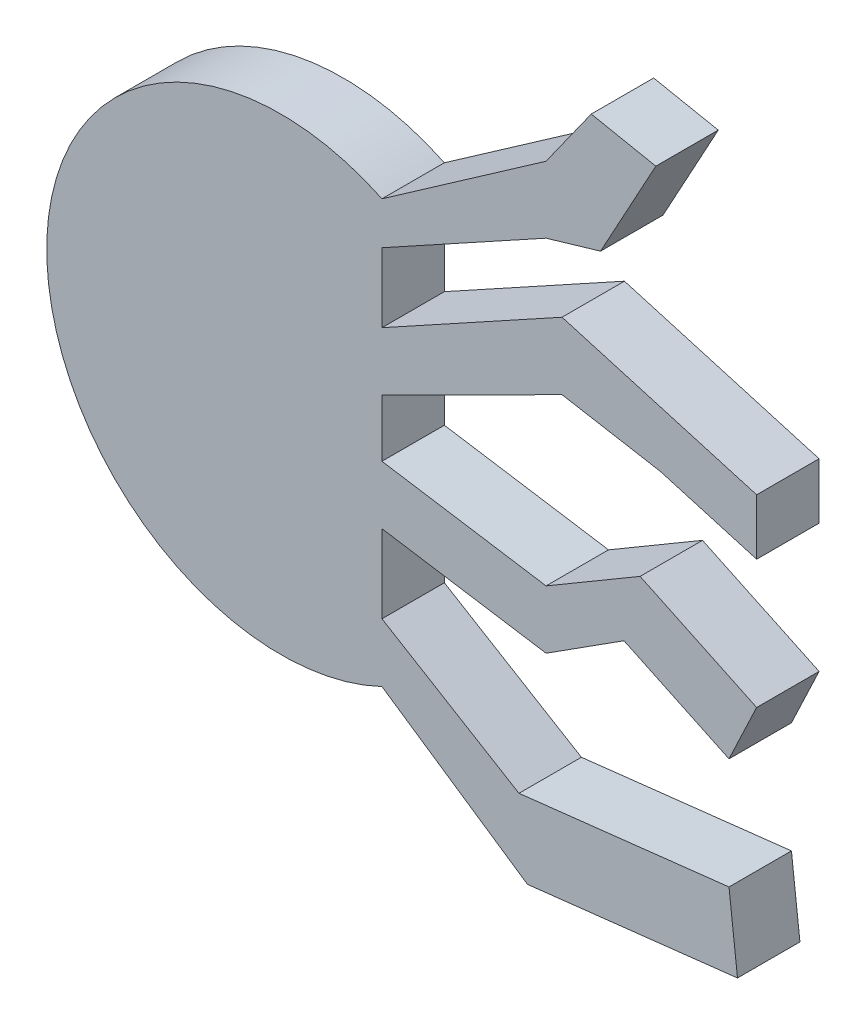
from build123d import *

# Parameters (mm, degrees)
BOSS_EXTRUDE1_DEPTH = 6
SKETCH2_R           = 5
CUT_EXTRUDE1_DEPTH  = 3


with BuildPart() as part:
    # Sketch1 → Boss-Extrude1 (new body)
    with BuildSketch(Plane(origin=(0, 0, 0), x_dir=(0, 1, 0), z_dir=(0, 0, 1))):
        with BuildLine():
            Line((16.223609114, -9.713238737), (9.569519391, -9.713238737))
            Line((9.569519391, -9.713238737), (19.093109625, -27.018057697))
            Line((19.093109625, -27.018057697), (13.668710041, -45.720503906))
            Line((13.668710041, -45.720503906), (8.303421987, -45.720503906))
            Line((8.303421987, -45.720503906), (10.986066014, -36.471184268))
            Line((10.986066014, -36.471184268), (12.646750412, -27.018057697))
            Line((12.646750412, -27.018057697), (3.960093563, -9.713238737))
            Line((3.960093563, -9.713238737), (-1.54802471, -9.713238737))
            Line((-1.54802471, -9.713238737), (-4.031835178, -25.485118253))
            Line((-4.031835178, -25.485118253), (1.277145856, -34.519377583))
            Line((1.277145856, -34.519377583), (-4.031835178, -45.720503906))
            Line((-4.031835178, -45.720503906), (-9.637527873, -43.063582152))
            Line((-9.637527873, -43.063582152), (-4.854308239, -32.971730814))
            Line((-4.854308239, -32.971730814), (-9.637527873, -25.485118253))
            Line((-9.637527873, -25.485118253), (-7.153717404, -9.713238737))
            Line((-7.153717404, -9.713238737), (-14.656334984, -9.713238737))
            Line((-14.656334984, -9.713238737), (-22.594802565, -22.879879476))
            Line((-22.594802565, -22.879879476), (-20.295393399, -43.063582152))
            Line((-20.295393399, -43.063582152), (-27.465165035, -43.880391579))
            Line((-27.465165035, -43.880391579), (-29.764574201, -23.696688902))
            Line((-29.764574201, -23.696688902), (-20.295393399, -9.713238737))
            ThreePointArc((-20.295393399, -9.713238737), (0, 22.5), (20.295393399, -9.713238737))
            Line((20.295393399, -9.713238737), (31.307295072, -25.485118253))
            Line((31.307295072, -25.485118253), (37.404948205, -29.824166519))
            Line((37.404948205, -29.824166519), (36.171384738, -36.030726629))
            Line((36.171384738, -36.030726629), (26.443205406, -30.722661353))
            Line((26.443205406, -30.722661353), (24.903556479, -25.485118253))
            Line((24.903556479, -25.485118253), (16.223609114, -9.713238737))
        make_face()
    extrude(amount=BOSS_EXTRUDE1_DEPTH)

    # Sketch2 → Cut-Extrude1 (cut)
    with BuildSketch(Plane(origin=(0, 0, 0), x_dir=(1, 0, 0), z_dir=(0, 0, -1))):
        with Locations(Location((0, 0, 0), (0, 0, 180))):
            Circle(SKETCH2_R)
    extrude(amount=-CUT_EXTRUDE1_DEPTH, mode=Mode.SUBTRACT)


solid = part.part
